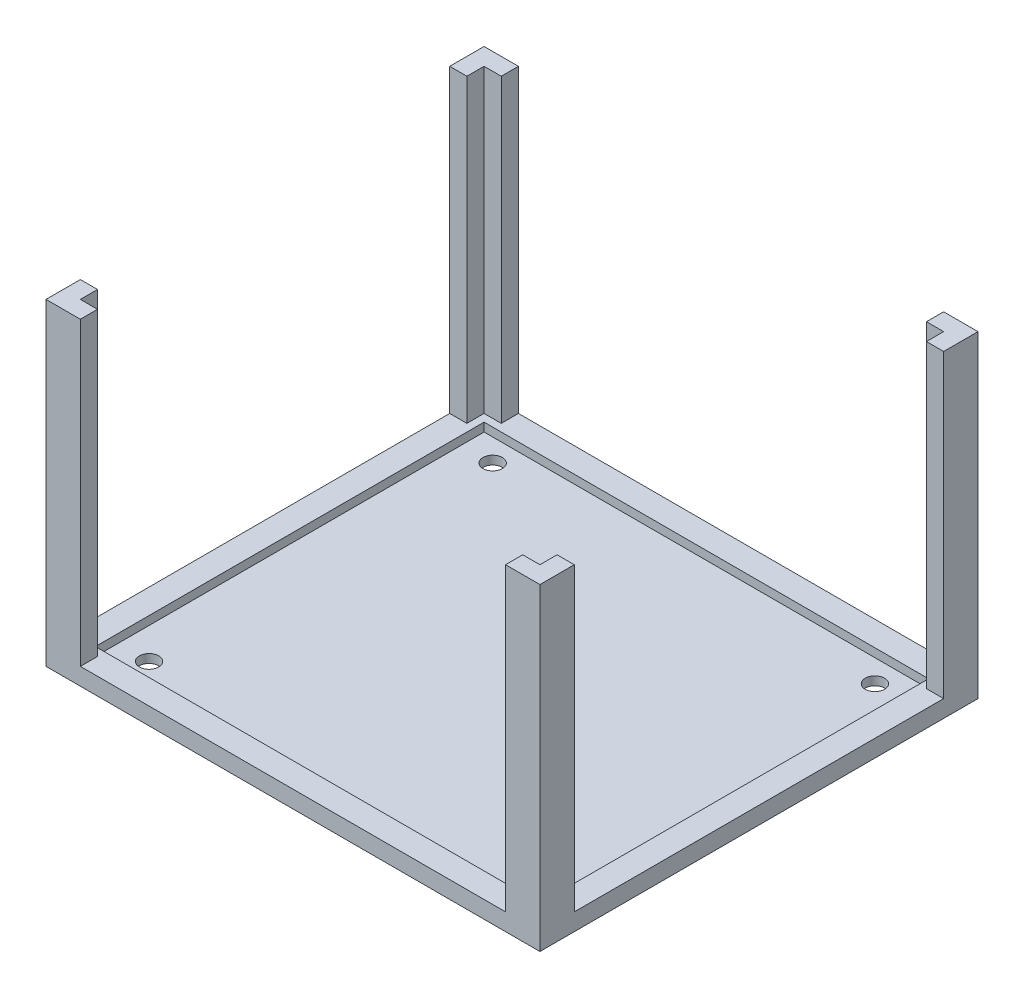
from build123d import *

# Parameters (mm, degrees)
SKETCH1_W           = 115
SKETCH1_H           = 102
BOSS_EXTRUDE1_DEPTH = 4
SKETCH11_W          = 103.5
SKETCH11_H          = 90.5
CUT_EXTRUDE5_DEPTH  = 2
SKETCH16_R          = 2.25
CUT_EXTRUDE7_DEPTH  = 13
BOSS_EXTRUDE4_DEPTH = 70


with BuildPart() as part:
    # Sketch1 → Boss-Extrude1 (new body)
    with BuildSketch(Plane(origin=(0, 0, 0), x_dir=(1, 0, 0), z_dir=(0, 1, 0))):
        with Locations((57.5, 51)):
            Rectangle(SKETCH1_W, SKETCH1_H)
    extrude(amount=BOSS_EXTRUDE1_DEPTH)

    # Sketch11 → Cut-Extrude5 (cut)
    with BuildSketch(Plane(origin=(0, 4, 0), x_dir=(1, 0, 0), z_dir=(0, 1, 0))):
        with Locations((57.5, 51)):
            Rectangle(SKETCH11_W, SKETCH11_H)
    extrude(amount=-CUT_EXTRUDE5_DEPTH, mode=Mode.SUBTRACT)

    # Sketch16 → Cut-Extrude7 (cut)
    with BuildSketch(Plane(origin=(0, 2, 0), x_dir=(1, 0, 0), z_dir=(0, 1, 0))):
        with Locations(Location((13, 11, 0), (0, 0, 270))):
            Circle(SKETCH16_R)
        with Locations(Location((13, 91, 0), (0, 0, 270))):
            Circle(SKETCH16_R)
        with Locations(Location((102, 91, 0), (0, 0, 270))):
            Circle(SKETCH16_R)
        with Locations(Location((102, 11, 0), (0, 0, 270))):
            Circle(SKETCH16_R)
    extrude(amount=-CUT_EXTRUDE7_DEPTH, mode=Mode.SUBTRACT)

    # Sketch6 → Boss-Extrude4 (add)
    with BuildSketch(Plane(origin=(0, 4, 0), x_dir=(1, 0, 0), z_dir=(0, 1, 0))):
        Polygon((0, 0), (0, 8), (4, 8), (4, 4), (8, 4), (8, 0), align=None)
        Polygon((107, 0), (115, 0), (115, 8), (111, 8), (111, 4), (107, 4), align=None)
        Polygon((107, 102), (115, 102), (115, 94), (111, 94), (111, 98), (107, 98), align=None)
        Polygon((8, 102), (0, 102), (0, 94), (4, 94), (4, 98), (8, 98), align=None)
    extrude(amount=BOSS_EXTRUDE4_DEPTH)


solid = part.part
